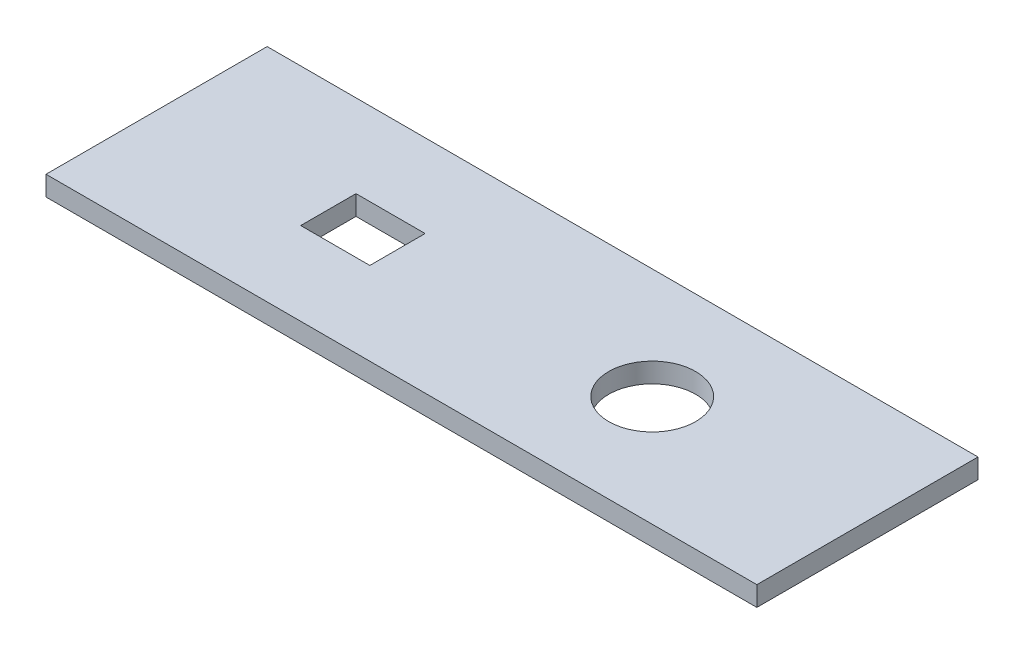
from build123d import *

# Parameters (mm, degrees)
IZIM1_W                     = 180
IZIM1_H                     = 56
IZIM1_R                     = 11
IZIM1_W_2                   = 17.5
IZIM1_H_2                   = 14
Y_KSEKLIK_EKSTR_ZYON1_DEPTH = 5


with BuildPart() as part:
    # Çizim1 → Yükseklik-Ekstrüzyon1 (new body)
    with BuildSketch(Plane(origin=(0, 0, 0), x_dir=(1, 0, 0), z_dir=(0, 1, 0))):
        Rectangle(IZIM1_W, IZIM1_H)
        with Locations(Location((35.5, 0, 0), (0, 0, 270))):
            Circle(IZIM1_R, mode=Mode.SUBTRACT)
        with Locations((-37.75, 0)):
            Rectangle(IZIM1_W_2, IZIM1_H_2, mode=Mode.SUBTRACT)
    extrude(amount=Y_KSEKLIK_EKSTR_ZYON1_DEPTH)


solid = part.part
